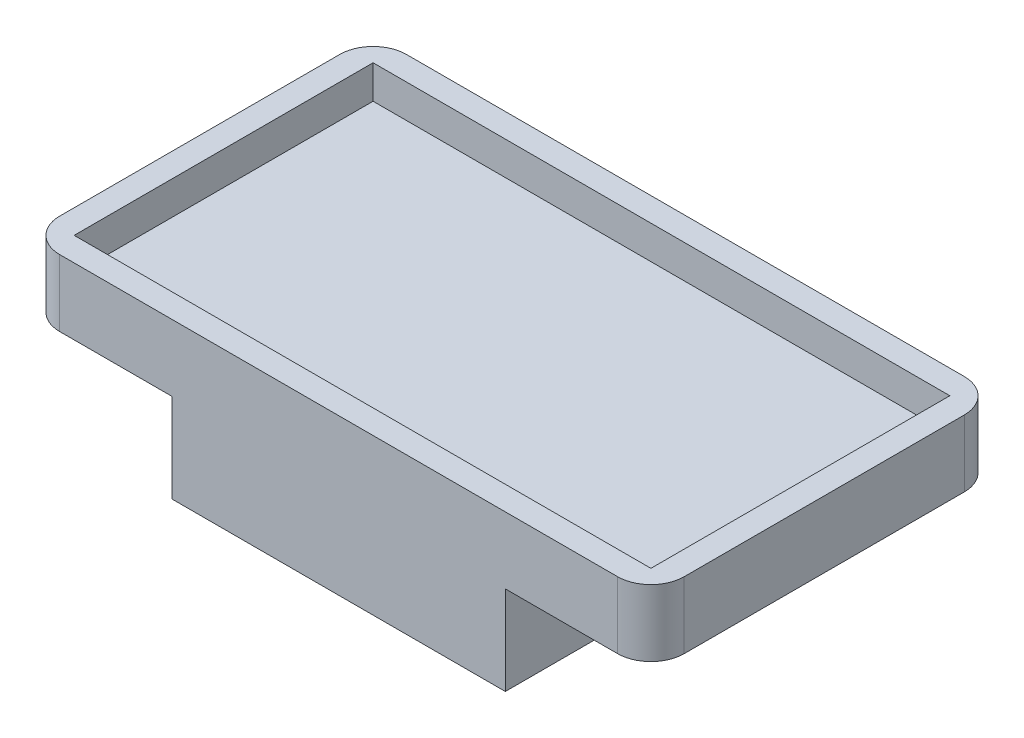
from build123d import *

# Parameters (mm, degrees)
CROQUIS1_W              = 56.2
CROQUIS1_H              = 31.2
SALIENTE_EXTRUIR1_DEPTH = 6
CROQUIS3_W              = 51.9
CROQUIS3_H              = 26.9
CORTAR_EXTRUIR1_DEPTH   = 3
CROQUIS5_W              = 56.2
CROQUIS5_H              = 18
SALIENTE_EXTRUIR2_DEPTH = 8
CROQUIS6_W              = 13.3
CROQUIS6_H              = 3.9
CORTAR_EXTRUIR2_DEPTH   = 64.385171768
CROQUIS7_W              = 13.1
CROQUIS7_H              = 8
CORTAR_EXTRUIR3_DEPTH   = 57.729533754
REDONDEO3_R             = 3


with BuildPart() as part:
    # Croquis1 → Saliente-Extruir1 (new body)
    with BuildSketch(Plane(origin=(0, 0, 0), x_dir=(1, 0, 0), z_dir=(0, 1, 0))):
        with Locations((25.1, 12.6)):
            Rectangle(CROQUIS1_W, CROQUIS1_H)
    extrude(amount=SALIENTE_EXTRUIR1_DEPTH)

    # Croquis3 → Cortar-Extruir1 (cut)
    with BuildSketch(Plane(origin=(0, 6, 0), x_dir=(1, 0, 0), z_dir=(0, 1, 0))):
        with Locations((25.1, 12.6)):
            Rectangle(CROQUIS3_W, CROQUIS3_H)
    extrude(amount=-CORTAR_EXTRUIR1_DEPTH, mode=Mode.SUBTRACT)

    # Croquis5 → Saliente-Extruir2 (add)
    with BuildSketch(Plane.XZ):
        with Locations((25.1, -6)):
            Rectangle(CROQUIS5_W, CROQUIS5_H)
    extrude(amount=SALIENTE_EXTRUIR2_DEPTH)

    # Croquis6 → Cortar-Extruir2 (cut, through all)
    with BuildSketch(Plane.ZY.offset(3)):
        with Locations((-8.35, -1.95)):
            Rectangle(CROQUIS6_W, CROQUIS6_H)
    extrude(amount=-CORTAR_EXTRUIR2_DEPTH, mode=Mode.SUBTRACT)

    # Croquis7 → Cortar-Extruir3 (cut, through all)
    with BuildSketch(Plane(origin=(0, 0, -15), x_dir=(-1, 0, 0), z_dir=(0, 0, -1))):
        with Locations((-46.65, -4)):
            Rectangle(CROQUIS7_W, CROQUIS7_H)
        with Locations((-3.55, -4)):
            Rectangle(CROQUIS7_W, CROQUIS7_H)
    extrude(amount=-CORTAR_EXTRUIR3_DEPTH, mode=Mode.SUBTRACT)

    # Redondeo3
    redondeo3_edges = [part.edges().sort_by_distance(p)[0] for p in [
        (-3, 3, -28.2),
        (53.2, 3, -28.2),
        (53.2, 3, 3),
        (-3, 3, 3),
    ]]
    fillet(redondeo3_edges, radius=REDONDEO3_R)


solid = part.part
